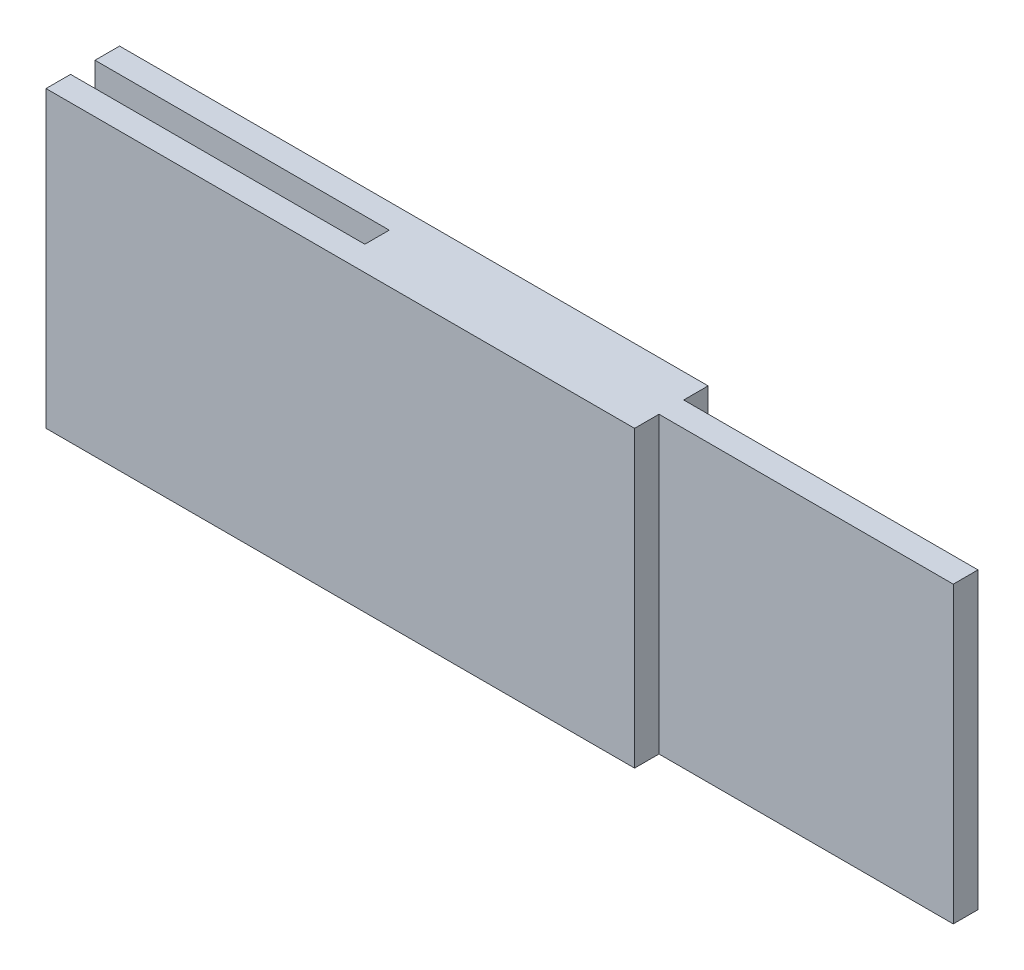
from build123d import *

# Parameters (mm, degrees)
SKETCH1_W           = 60
SKETCH1_H           = 20
BOSS_EXTRUDE1_DEPTH = 2.5
SKETCH2_W           = 20
SKETCH2_H           = 1.66
CUT_EXTRUDE1_DEPTH  = 37.142080737


with BuildPart() as part:
    # Sketch1 → Boss-Extrude1 (new, symmetric)
    with BuildSketch(Plane.XY):
        Rectangle(SKETCH1_W, SKETCH1_H)
    extrude(amount=BOSS_EXTRUDE1_DEPTH, both=True)

    # Sketch2 → Cut-Extrude1 (cut, through all)
    with BuildSketch(Plane(origin=(0, 10, 0), x_dir=(1, 0, 0), z_dir=(0, 1, 0))):
        with Locations((-20, 0)):
            Rectangle(SKETCH2_W, SKETCH2_H)
        with Locations((20, 1.67)):
            Rectangle(SKETCH2_W, SKETCH2_H)
        with Locations((20, -1.67)):
            Rectangle(SKETCH2_W, SKETCH2_H)
    extrude(amount=-CUT_EXTRUDE1_DEPTH, mode=Mode.SUBTRACT)


solid = part.part
